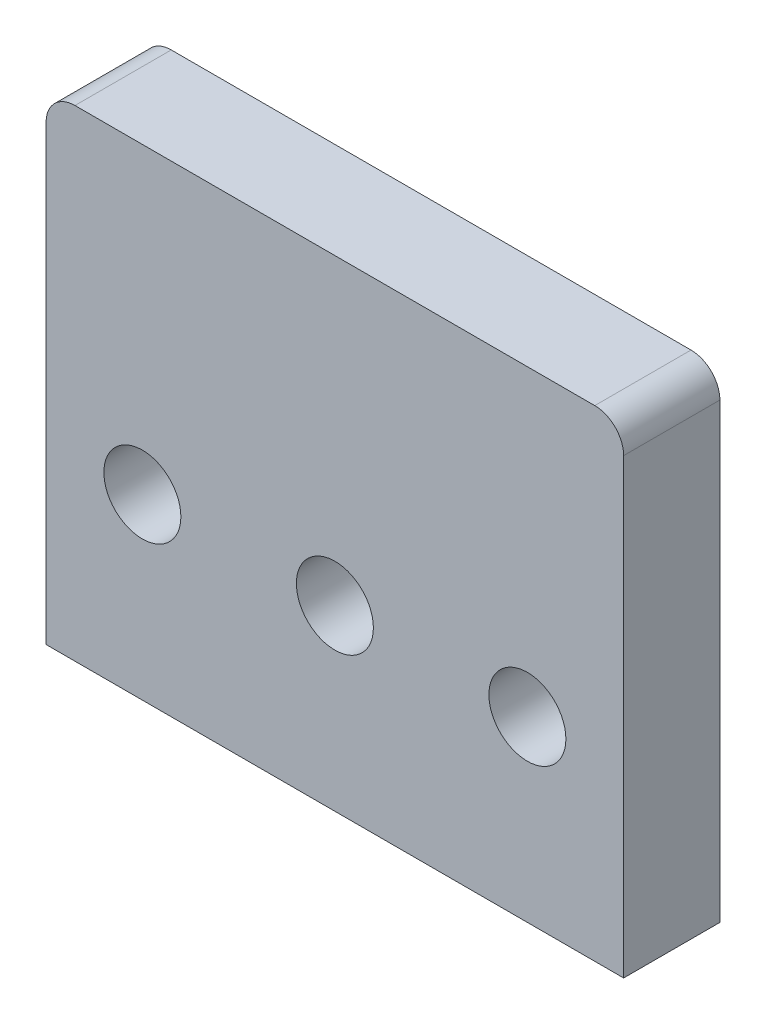
from build123d import *

# Parameters (mm, degrees)
ESQUISSE1_W             = 60
ESQUISSE1_H             = 50
BASE_EXTRUSION_DEPTH    = 10
CONG_1_R                = 3
ESQUISSE2_R             = 4
ENL_V_MAT_EXTRU_1_DEPTH = 10


with BuildPart() as part:
    # Esquisse1 → Base-Extrusion (new body)
    with BuildSketch(Plane.XY):
        with Locations((0, 6.5)):
            Rectangle(ESQUISSE1_W, ESQUISSE1_H)
    extrude(amount=BASE_EXTRUSION_DEPTH)

    # Congé1
    cong_1_edges = [part.edges().sort_by_distance(p)[0] for p in [
        (30, 31.5, 5),
        (-30, 31.5, 5),
    ]]
    fillet(cong_1_edges, radius=CONG_1_R)

    # Esquisse2 → Enlèv. mat.-Extru.1 (cut)
    with BuildSketch(Plane.XY.offset(10)):
        with Locations((-20, 0)):
            Circle(ESQUISSE2_R)
        Circle(ESQUISSE2_R)
        with Locations((20, 0)):
            Circle(ESQUISSE2_R)
    extrude(amount=-ENL_V_MAT_EXTRU_1_DEPTH, mode=Mode.SUBTRACT)


solid = part.part
